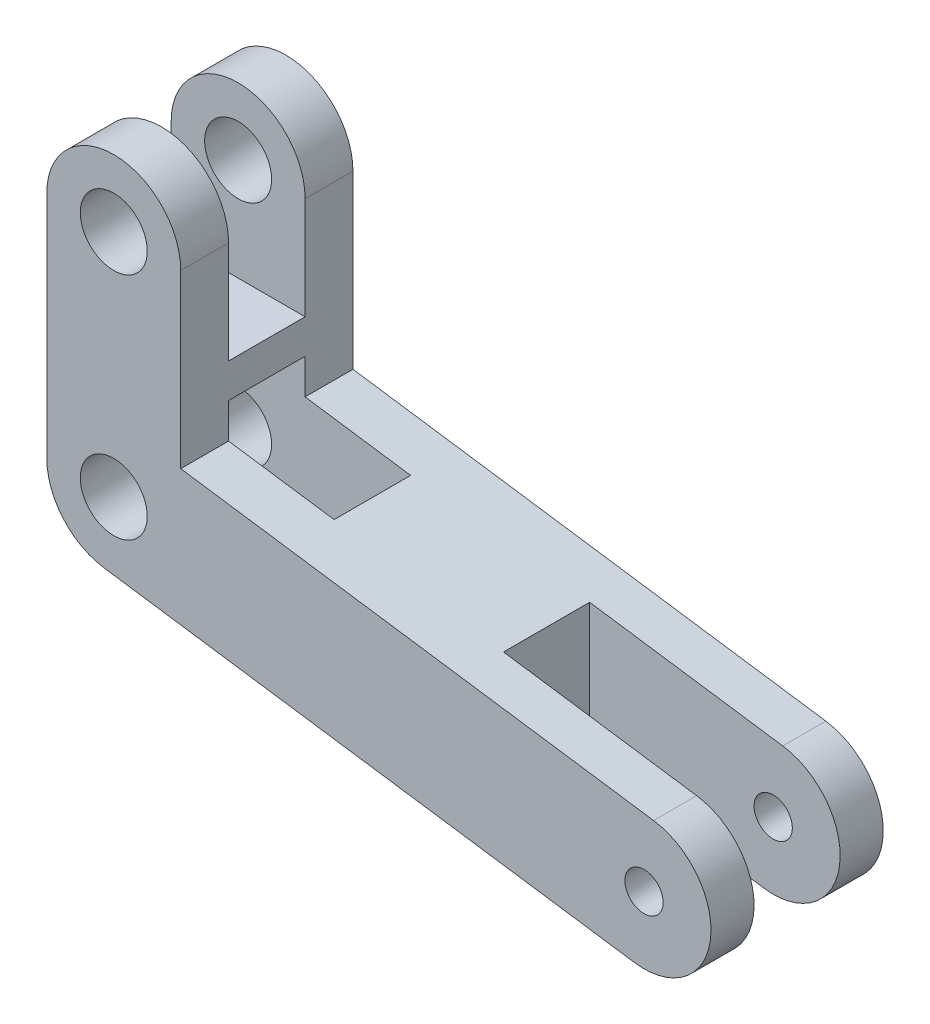
from build123d import *

# Parameters (mm, degrees)
SKETCH_1_R          = 1.75
SKETCH_1_R_2        = 1
EXTRUDE_1_DEPTH     = 4.5
SKETCH_5_W          = 9.199682462
SKETCH_5_H          = 9.813167506
SKETCH_5_W_2        = 14.660354758
SKETCH_5_H_2        = 10.525453646
CUT_EXTRUDE_3_DEPTH = 2
SKETCH_6_W          = 19.186818514
SKETCH_6_H          = 12
CUT_EXTRUDE_4_DEPTH = 2.25


with BuildPart() as part:
    # 草图1 → 凸台-拉伸1 (new, symmetric)
    with BuildSketch(Plane.XY):
        with BuildLine():
            Line((27.212812921, -7.464101615), (-0.5, -3.464101615))
            ThreePointArc((-0.5, -3.464101615), (-2.645751311, -2.291287847), (-3.5, 0))
            Line((-3.5, 0), (-3.5, 12))
            ThreePointArc((-3.5, 12), (0, 15.5), (3.5, 12))
            Line((3.5, 12), (3.5, 3.031088913))
            Line((3.5, 3.031088913), (28.212812921, -0.535898385))
            ThreePointArc((28.212812921, -0.535898385), (31.176914536, -4.5), (27.212812921, -7.464101615))
        make_face()
        Circle(SKETCH_1_R, mode=Mode.SUBTRACT)
        with Locations((0, 12)):
            Circle(SKETCH_1_R, mode=Mode.SUBTRACT)
        with Locations((27.712812921, -4)):
            Circle(SKETCH_1_R_2, mode=Mode.SUBTRACT)
    extrude(amount=EXTRUDE_1_DEPTH, both=True)

    # 草图5 → 切除-拉伸3 (cut, symmetric)
    with BuildSketch(Plane.XY):
        with Locations((-1.099841231, 11.563279791)):
            Rectangle(SKETCH_5_W, SKETCH_5_H)
        with Locations((1.684655549, -0.393377614)):
            Rectangle(SKETCH_5_W_2, SKETCH_5_H_2)
    extrude(amount=CUT_EXTRUDE_3_DEPTH, both=True, mode=Mode.SUBTRACT)

    # 草图6 → 切除-拉伸4 (cut, symmetric)
    with BuildSketch(Plane.XY):
        with Locations((27.712812921, -4)):
            Rectangle(SKETCH_6_W, SKETCH_6_H)
    extrude(amount=CUT_EXTRUDE_4_DEPTH, both=True, mode=Mode.SUBTRACT)


solid = part.part
